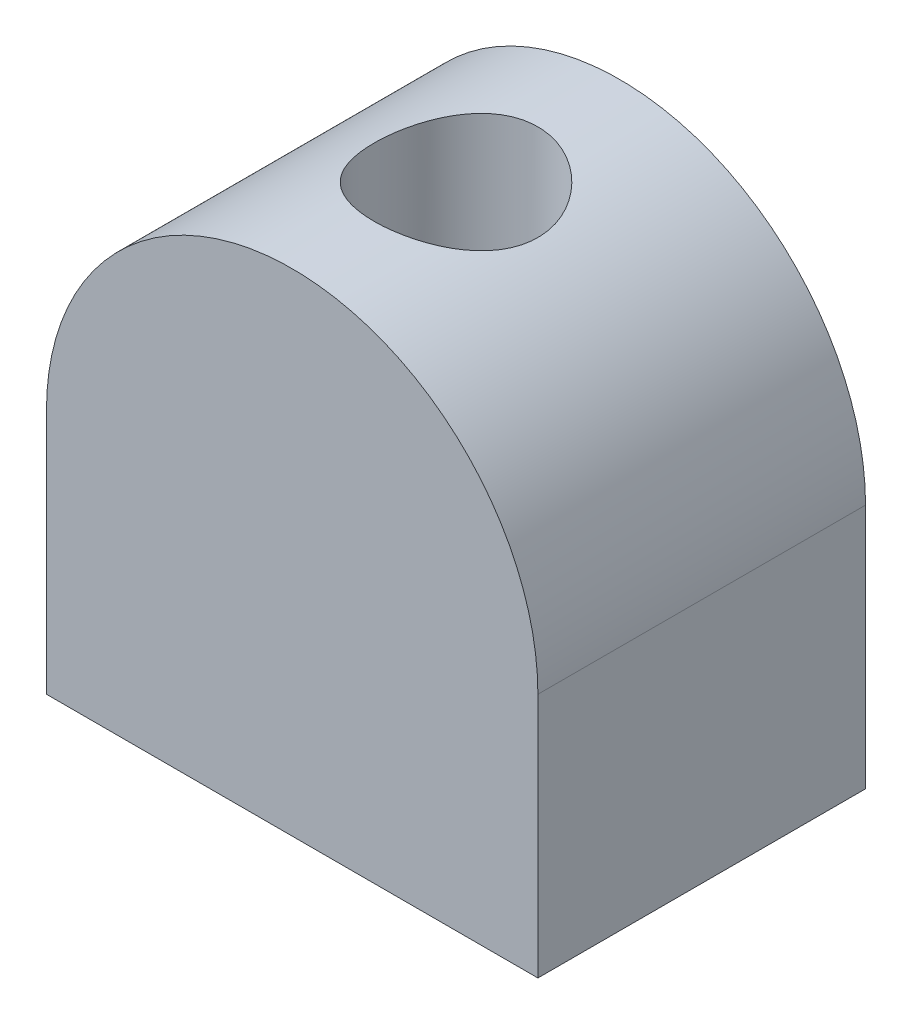
from build123d import *

# Parameters (mm, degrees)
BOSS_EXTRUDE1_DEPTH                                 = 10
CBORE_FOR_M5_HEX_SOCKET_HEAD_CAP_SCREW1_D           = 5.5
CBORE_FOR_M5_HEX_SOCKET_HEAD_CAP_SCREW1_CBORE_D     = 10
CBORE_FOR_M5_HEX_SOCKET_HEAD_CAP_SCREW1_CBORE_DEPTH = 8


with BuildPart() as part:
    # Sketch1 → Boss-Extrude1 (new, symmetric)
    with BuildSketch(Plane.XY):
        with BuildLine():
            Line((-15, 7.5), (-15, -7.5))
            Line((-15, -7.5), (15, -7.5))
            Line((15, -7.5), (15, 7.5))
            ThreePointArc((15, 7.5), (0, 22.5), (-15, 7.5))
        make_face()
    extrude(amount=BOSS_EXTRUDE1_DEPTH, both=True)

    # CBORE for M5 Hex Socket Head Cap Screw1 (through all)
    with Locations(Plane(origin=(0, 22.5, 0), x_dir=(1, 0, 0), z_dir=(0, 1, 0))):
        with Locations((0, 0)):
            CounterBoreHole(CBORE_FOR_M5_HEX_SOCKET_HEAD_CAP_SCREW1_D / 2, CBORE_FOR_M5_HEX_SOCKET_HEAD_CAP_SCREW1_CBORE_D / 2, CBORE_FOR_M5_HEX_SOCKET_HEAD_CAP_SCREW1_CBORE_DEPTH)


solid = part.part
